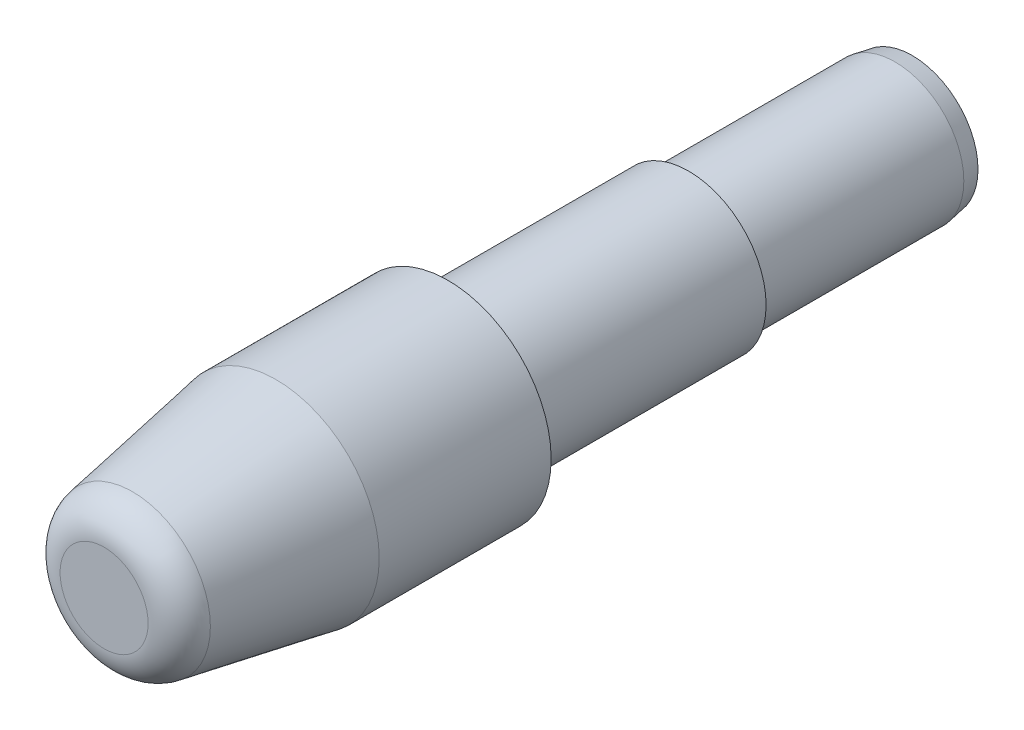
from build123d import *

# Parameters (mm, degrees)
CROQUIS1_R              = 6
SALIENTE_EXTRUIR1_DEPTH = 10
CROQUIS2_R              = 6
SALIENTE_EXTRUIR2_DEPTH = 10
CHAFL_N1_SIZE           = 10
CHAFL_N1_SIZE2          = 1.763269807
REDONDEO1_R             = 2
CROQUIS3_R              = 4.5
SALIENTE_EXTRUIR3_DEPTH = 14
CROQUIS4_R              = 4
SALIENTE_EXTRUIR4_DEPTH = 13
CHAFL_N2_SIZE           = 1
CHAFL_N2_SIZE2          = 0.176326981


with BuildPart() as part:
    # Croquis1 → Saliente-Extruir1 (new body)
    with BuildSketch(Plane.XY):
        Circle(CROQUIS1_R)
    extrude(amount=SALIENTE_EXTRUIR1_DEPTH)

    # Croquis2 → Saliente-Extruir2 (add)
    with BuildSketch(Plane.XY.offset(10)):
        Circle(CROQUIS2_R)
    extrude(amount=SALIENTE_EXTRUIR2_DEPTH)

    # Chaflán1
    chafl_n1_edges = [part.edges().sort_by_distance(p)[0] for p in [
        (-6, 0, 20),
    ]]
    chafl_n1_side = [part.faces().sort_by_distance(p)[0] for p in [
        (-6, 0, 10),
    ]]
    chamfer(chafl_n1_edges, length=CHAFL_N1_SIZE, length2=CHAFL_N1_SIZE2, reference=chafl_n1_side[0])

    # Redondeo1
    redondeo1_edges = [part.edges().sort_by_distance(p)[0] for p in [
        (-4.236730193, 0, 20),
    ]]
    fillet(redondeo1_edges, radius=REDONDEO1_R)

    # Croquis3 → Saliente-Extruir3 (add)
    with BuildSketch(Plane(origin=(0, 0, 0), x_dir=(-1, 0, 0), z_dir=(0, 0, -1))):
        with Locations(Location((0, 0, 0), (0, 0, 180))):
            Circle(CROQUIS3_R)
    extrude(amount=SALIENTE_EXTRUIR3_DEPTH)

    # Croquis4 → Saliente-Extruir4 (add)
    with BuildSketch(Plane(origin=(0, 0, -14), x_dir=(-1, 0, 0), z_dir=(0, 0, -1))):
        with Locations(Location((0, 0, 0), (0, 0, 180))):
            Circle(CROQUIS4_R)
    extrude(amount=SALIENTE_EXTRUIR4_DEPTH)

    # Chaflán2
    chafl_n2_edges = [part.edges().sort_by_distance(p)[0] for p in [
        (-4, 0, -27),
    ]]
    chafl_n2_side = [part.faces().sort_by_distance(p)[0] for p in [
        (-4, 0, -20.5),
    ]]
    chamfer(chafl_n2_edges, length=CHAFL_N2_SIZE, length2=CHAFL_N2_SIZE2, reference=chafl_n2_side[0])


solid = part.part
